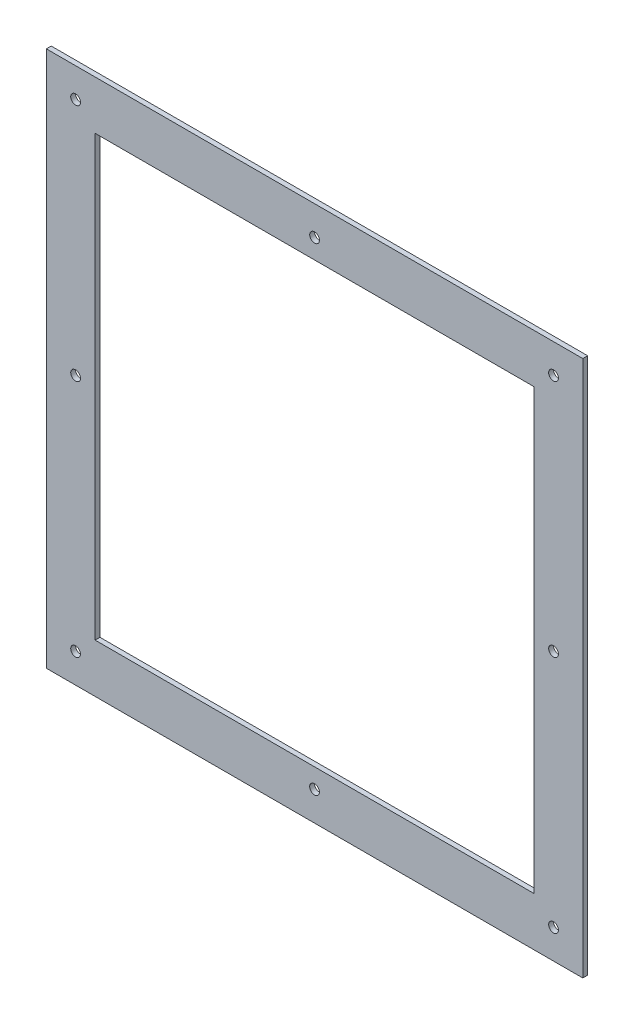
from build123d import *

# Parameters (mm, degrees)
SKETCH1_W                 = 220
SKETCH1_H                 = 220
SKETCH1_W_2               = 180
SKETCH1_H_2               = 180
EXTRUDE_THIN1_DEPTH       = 2
SKETCH2_R                 = 2
CUT_EXTRUDE1_DEPTH        = 10
LPATTERN1_COUNT           = 2
LPATTERN1_PITCH           = 98
LPATTERN1_COL_COUNT       = 2
LPATTERN1_COL_PITCH       = 98
LPATTERN2_COPY_1_SKETCH_R = 2
LPATTERN2_COPY_1_DEPTH    = 10
LPATTERN2_COPY_2_SKETCH_R = 2
LPATTERN2_COPY_2_DEPTH    = 10
LPATTERN2_COPY_3_SKETCH_R = 2
LPATTERN2_COPY_3_DEPTH    = 10
LPATTERN2_COPY_4_SKETCH_R = 2
LPATTERN2_COPY_4_DEPTH    = 10
LPATTERN3_COUNT           = 3
LPATTERN3_PITCH           = 196


with BuildPart() as part:
    # Sketch1 → Extrude-Thin1 (new body)
    with BuildSketch(Plane.XY):
        Rectangle(SKETCH1_W, SKETCH1_H)
        Rectangle(SKETCH1_W_2, SKETCH1_H_2, mode=Mode.SUBTRACT)
    extrude(amount=EXTRUDE_THIN1_DEPTH)

    # Sketch2 → Cut-Extrude1 (cut)
    with BuildSketch(Plane.XY.offset(2)):
        with Locations((0, 98)):
            Circle(SKETCH2_R)
    cut_extrude1 = extrude(amount=-CUT_EXTRUDE1_DEPTH, mode=Mode.SUBTRACT)

    # LPattern1: Cut-Extrude1 ×2
    with Locations(*[(i * LPATTERN1_PITCH, 0, 0) for i in range(1, LPATTERN1_COUNT)]):
        add(cut_extrude1, mode=Mode.SUBTRACT)

    # LPattern1 col: Cut-Extrude1 ×2
    with Locations(*[(-i * LPATTERN1_COL_PITCH, 0, 0) for i in range(1, LPATTERN1_COL_COUNT)]):
        add(cut_extrude1, mode=Mode.SUBTRACT)

    # LPattern2 copy 1 sketch → LPattern2 copy 1 (cut)
    with BuildSketch(Plane(origin=(98, -98, 2), x_dir=(1, 0, 0), z_dir=(0, 0, 1))):
        with Locations((0, 98)):
            Circle(LPATTERN2_COPY_1_SKETCH_R)
    extrude(amount=-LPATTERN2_COPY_1_DEPTH, mode=Mode.SUBTRACT)

    # LPattern2 copy 2 sketch → LPattern2 copy 2 (cut)
    with BuildSketch(Plane(origin=(98, -196, 2), x_dir=(1, 0, 0), z_dir=(0, 0, 1))):
        with Locations((0, 98)):
            Circle(LPATTERN2_COPY_2_SKETCH_R)
    extrude(amount=-LPATTERN2_COPY_2_DEPTH, mode=Mode.SUBTRACT)

    # LPattern2 copy 3 sketch → LPattern2 copy 3 (cut)
    with BuildSketch(Plane(origin=(-98, -98, 2), x_dir=(1, 0, 0), z_dir=(0, 0, 1))):
        with Locations((0, 98)):
            Circle(LPATTERN2_COPY_3_SKETCH_R)
    extrude(amount=-LPATTERN2_COPY_3_DEPTH, mode=Mode.SUBTRACT)

    # LPattern2 copy 4 sketch → LPattern2 copy 4 (cut)
    with BuildSketch(Plane(origin=(-98, -196, 2), x_dir=(1, 0, 0), z_dir=(0, 0, 1))):
        with Locations((0, 98)):
            Circle(LPATTERN2_COPY_4_SKETCH_R)
    extrude(amount=-LPATTERN2_COPY_4_DEPTH, mode=Mode.SUBTRACT)

    # LPattern3: Cut-Extrude1 ×3
    with Locations(*[(0, -i * LPATTERN3_PITCH, 0) for i in range(1, LPATTERN3_COUNT)]):
        add(cut_extrude1, mode=Mode.SUBTRACT)


solid = part.part
